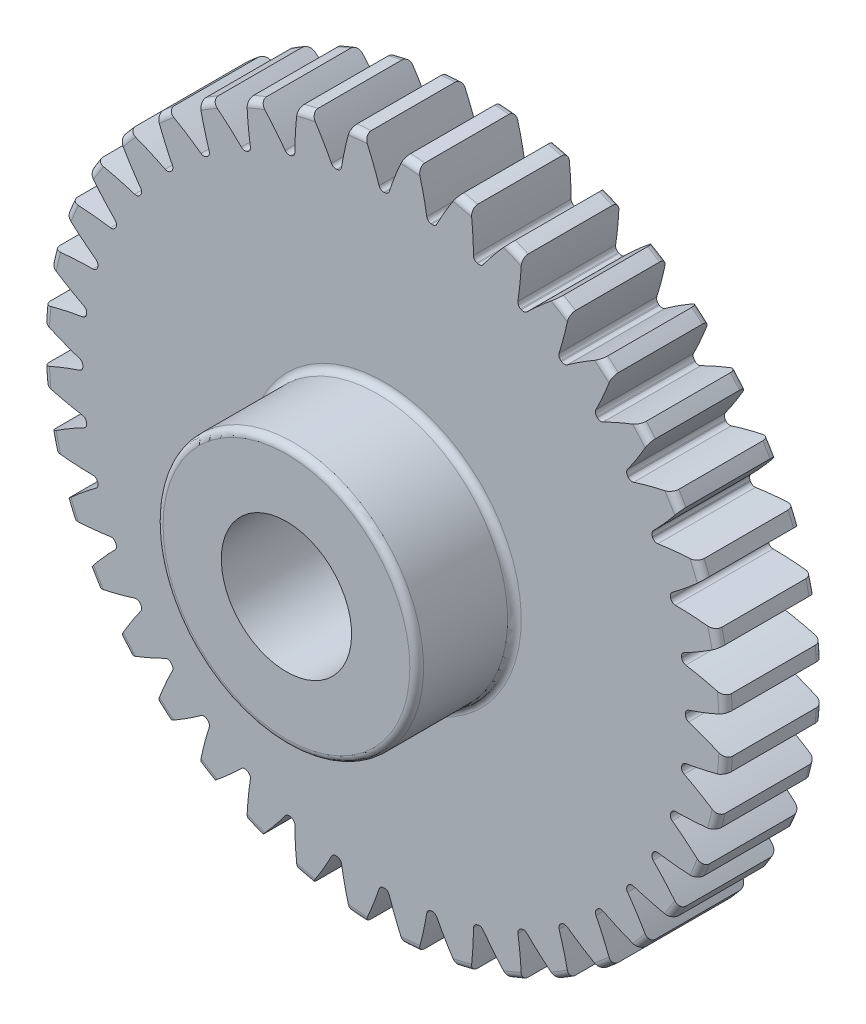
from build123d import *

# Parameters (mm, degrees)
FILLET2_R          = 0.42
CUT_EXTRUDE2_DEPTH = 31.298514884
CIRPATTERN1_COUNT  = 40


with BuildPart() as part:
    # Sketch4 → Revolve1 (revolve)
    with BuildSketch(Plane(origin=(0, 0, 0), x_dir=(0, 0, -1), z_dir=(1, 0, 0))):
        Polygon((-12, 4), (-12, 8), (-6, 8), (-6, 21), (0, 21), (0, 4), align=None)
    revolve(axis=Axis((0, 0, 6), (0, 0, 1)))

    # Fillet2
    fillet2_edges = [part.edges().sort_by_distance(p)[0] for p in [
        (0, -21, 0),
        (0, -21, 6),
        (0, -8, 6),
        (0, -8, 12),
    ]]
    fillet(fillet2_edges, radius=FILLET2_R)

    # Sketch7 → Cut-Extrude2 (cut, through all)
    with BuildSketch(Plane.XY.offset(6)):
        with BuildLine():
            ThreePointArc((-0.026958983, 18.499980357), (0, 18.5), (0.026958983, 18.499980357))
            ThreePointArc((0.026958983, 18.499980357), (0.202840783, 18.556625013), (0.312174396, 18.705585364))
            ThreePointArc((0.312174396, 18.705585364), (0.730273565, 19.848918998), (1.21715964, 20.96469705))
            ThreePointArc((1.21715964, 20.96469705), (0, 21), (-1.21715964, 20.96469705))
            ThreePointArc((-1.21715964, 20.96469705), (-0.730273565, 19.848918998), (-0.312174396, 18.705585364))
            ThreePointArc((-0.312174396, 18.705585364), (-0.202840783, 18.556625013), (-0.026958983, 18.499980357))
        make_face()
    cut_extrude2 = extrude(amount=-CUT_EXTRUDE2_DEPTH, mode=Mode.SUBTRACT)

    # CirPattern1: Cut-Extrude2 ×40 about axis
    cirpattern1_axis = Axis((0, 0, 0), (0, 0, 1))
    for i in range(1, CIRPATTERN1_COUNT):
        add(cut_extrude2.rotate(cirpattern1_axis, i * 360 / CIRPATTERN1_COUNT), mode=Mode.SUBTRACT)


solid = part.part
